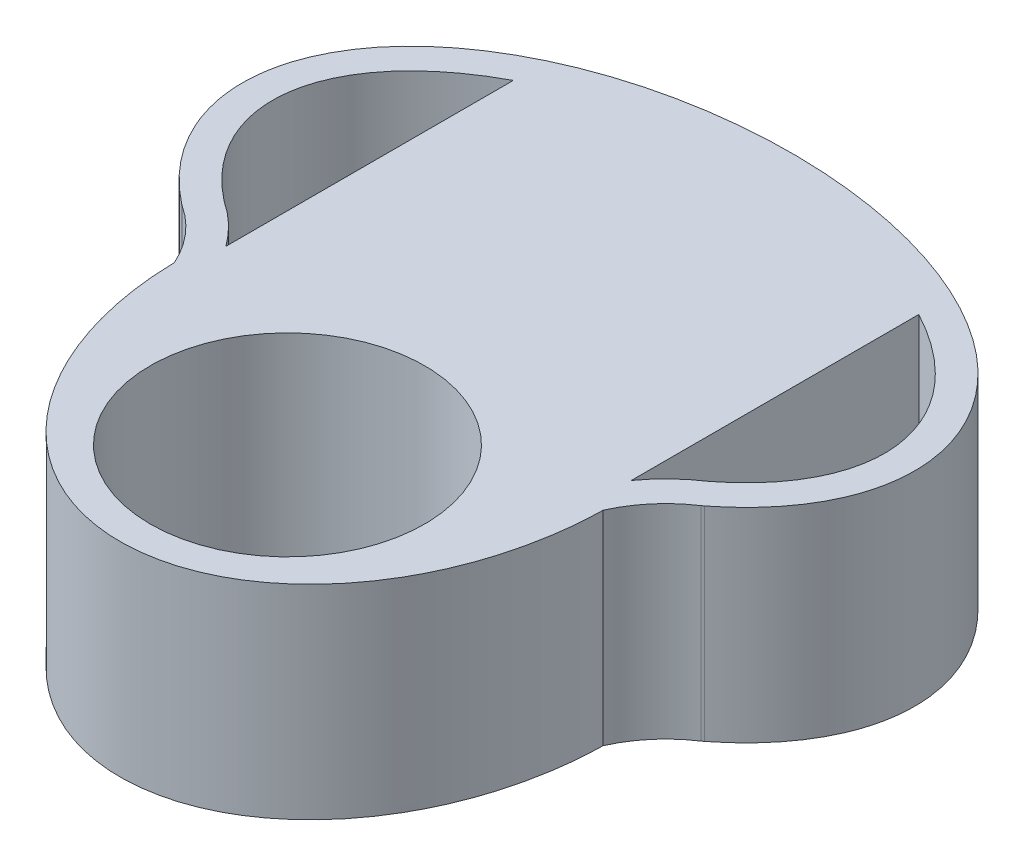
from build123d import *

# Parameters (mm, degrees)
SKETCH2_R           = 42.719462629
BOSS_EXTRUDE1_DEPTH = 63.5


with BuildPart() as part:
    # Sketch2 → Boss-Extrude1 (new body)
    with BuildSketch(Plane(origin=(0, 0, 0), x_dir=(1, 0, 0), z_dir=(0, 1, 0))):
        with BuildLine():
            add(Edge.make_bspline(
                [(-81.418271406, -42.145271175), (-82.170892978, -41.555605689), (-83.661947513, -40.34468266), (-86.504917126, -37.858902664), (-89.826106451, -34.605614461), (-93.402448477, -30.484129949), (-97.592609956, -24.708725497), (-101.670899734, -16.994783744), (-104.458923138, -7.121149558), (-104.935398087, 3.044819843), (-102.433523024, 16.436187317), (-93.803088458, 31.852958892), (-76.611247213, 46.872704612), (-54.178867472, 58.053706434), (-28.050376191, 64.98110667), (0, 67.331446665), (28.050376191, 64.98110667), (54.178867472, 58.053706434), (76.611247213, 46.872704612), (93.803088458, 31.852958892), (102.433523024, 16.436187317), (104.935398087, 3.044819843), (104.458923138, -7.121149558), (101.670899734, -16.994783744), (97.592609956, -24.708725497), (93.402448477, -30.484129949), (89.826106451, -34.605614461), (86.504917126, -37.858902664), (83.661947513, -40.34468266), (82.170892978, -41.555605689), (81.418271406, -42.145271175)],
                knots=[-0.653544264, -0.653544264, -0.653544264, -0.653544264, -0.618788942, -0.58403362, -0.514522977, -0.445012334, -0.37550169, -0.236480403, -0.097459116, 0.041562171, 0.180583458, 0.458626031, 0.736668605, 1.014711179, 1.292753753, 1.570796327, 1.848838901, 2.126881474, 2.404924048, 2.682966622, 2.961009196, 3.100030483, 3.23905177, 3.378073057, 3.517094344, 3.586604987, 3.656115631, 3.725626274, 3.760381596, 3.795136918, 3.795136918, 3.795136918, 3.795136918], degree=3))
            Line((-81.418271406, -42.145271175), (-80.782524238, -42.60195459))
            ThreePointArc((-80.782524238, -42.60195459), (-72.590288115, -49.838688832), (-66.759034423, -59.084203181))
            add(Edge.make_bspline(
                [(-66.759034423, -59.084203181), (-66.756215175, -59.24536099), (-66.661656556, -64.048566295), (-65.790713621, -74.286669871), (-62.365697816, -89.290962144), (-56.461216886, -103.979945176), (-45.725258503, -121.392835835), (-31.037649258, -134.546769237), (-13.714508461, -141.546891793), (0, -143.348554103), (13.714508461, -141.546891793), (31.037649258, -134.546769237), (45.725258503, -121.392835835), (56.461216886, -103.979945176), (62.365697816, -89.290962144), (65.790713621, -74.286669871), (66.661656556, -64.048566295), (66.756215175, -59.24536099), (66.759034423, -59.084203181)],
                knots=[-1.547568222, -1.547568222, -1.547568222, -1.547568222, -1.541761196, -1.374446786, -1.178097245, -0.981747704, -0.785398163, -0.392699082, -0.196349541, 0, 0.196349541, 0.392699082, 0.785398163, 0.981747704, 1.178097245, 1.374446786, 1.541761196, 1.547568222, 1.547568222, 1.547568222, 1.547568222], degree=3))
            ThreePointArc((66.759034423, -59.084203181), (72.590288115, -49.838688832), (80.782524238, -42.60195459))
            Line((80.782524238, -42.60195459), (81.418271406, -42.145271175))
        make_face()
        with BuildLine():
            Line((-63.117151263, 42.801443643), (-63.117151263, -46.696050008))
            ThreePointArc((-63.117151263, -46.696050008), (-68.826389344, -40.153156206), (-75.622200408, -34.74743602))
            add(Edge.make_bspline(
                [(-63.117151263, 42.801443643), (-129.572781961, 7.521875813), (-75.622200408, -34.74743602)],
                knots=[5.473145987, 5.473145987, 5.473145987, 6.936729571, 6.936729571, 6.936729571], degree=2, weights=[0.749177169, 0.633315632, 1]))
        make_face(mode=Mode.SUBTRACT)
        with BuildLine():
            add(Edge.make_bspline(
                [(63.117151263, 42.801443643), (85.588412535, 30.872034834), (103.059743747, 11.866002701), (100.457712976, -8.676182438), (89.289299072, -24.039509643), (75.622200408, -34.74743602)],
                knots=[5.473145987, 5.473145987, 5.473145987, 5.473145987, 5.473145987, 5.473145987, 6.936729571, 6.936729571, 6.936729571, 6.936729571, 6.936729571, 6.936729571], degree=5, weights=[1, 1, 0.972678032, 0.989522952, 1, 1]))
            ThreePointArc((75.622200408, -34.74743602), (68.826389344, -40.153156206), (63.117151263, -46.696050008))
            Line((63.117151263, -46.696050008), (63.117151263, 42.801443643))
        make_face(mode=Mode.SUBTRACT)
        with Locations(Location((0, -90.630537371, 0), (0, 0, 270))):
            Circle(SKETCH2_R, mode=Mode.SUBTRACT)
    extrude(amount=BOSS_EXTRUDE1_DEPTH)


solid = part.part
